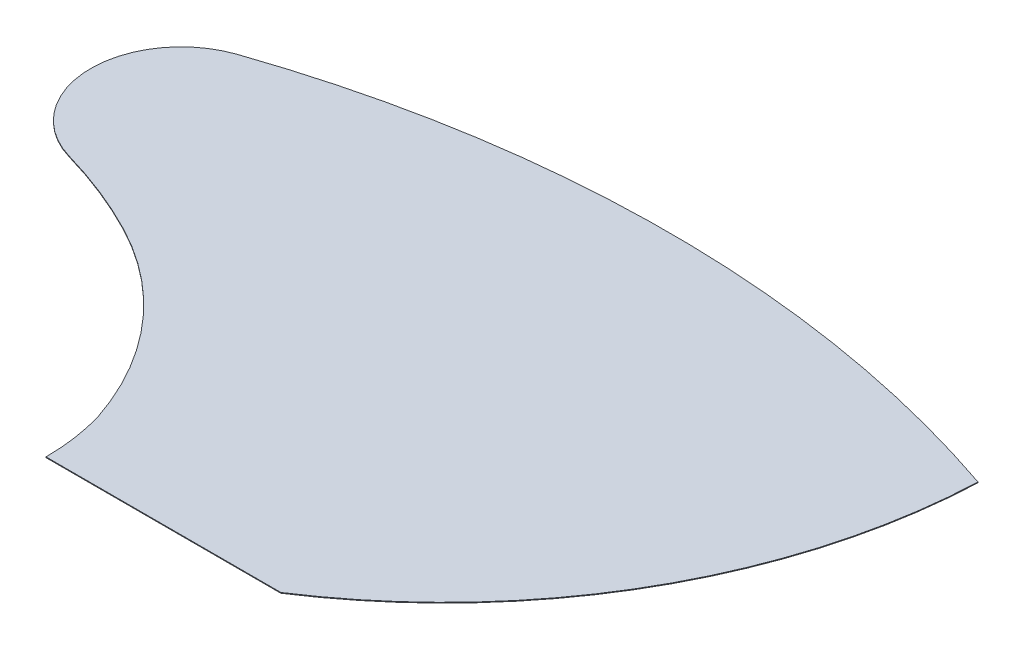
from build123d import *

# Parameters (mm, degrees)
BOSS_EXTRUDE1_DEPTH = 0.2


with BuildPart() as part:
    # Sketch1 → Boss-Extrude1 (new body)
    with BuildSketch(Plane(origin=(0, 0, 0), x_dir=(1, 0, 0), z_dir=(0, 1, 0))):
        with BuildLine():
            Line((77.011811156, 6.964256389), (142.011811156, 6.964256389))
            ThreePointArc((142.011811156, 6.964256389), (191.951985459, 59.934679973), (212.011811156, 129.916750371))
            ThreePointArc((212.011811156, 129.916750371), (109.511811156, 146.964256389), (7.011811156, 129.916750371))
            ThreePointArc((7.011811156, 129.916750371), (-9.888188844, 105.630981207), (8.216977412, 82.229879978))
            ThreePointArc((8.216977412, 82.229879978), (20.874474734, 77.910240919), (33.039776466, 72.353537417))
            ThreePointArc((33.039776466, 72.353537417), (58.584528324, 52.071980536), (74.626149336, 23.672292292))
            ThreePointArc((74.626149336, 23.672292292), (76.408302088, 15.402420833), (77.011811156, 6.964256389))
        make_face()
    extrude(amount=BOSS_EXTRUDE1_DEPTH)


solid = part.part
